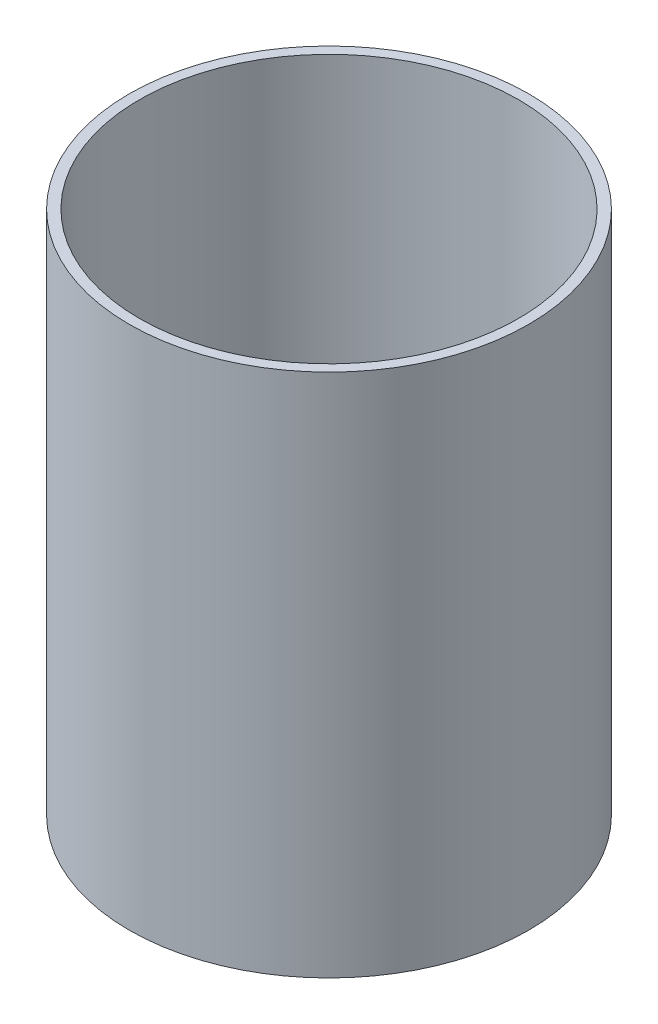
from build123d import *

# Parameters (mm, degrees)
SKETCH2_R           = 59
SKETCH2_R_2         = 56
BOSS_EXTRUDE2_DEPTH = 155


with BuildPart() as part:
    # Sketch2 → Boss-Extrude2 (new body)
    with BuildSketch(Plane(origin=(0, 0, 0), x_dir=(1, 0, 0), z_dir=(0, 1, 0))):
        with Locations(Location((0, 0, 0), (0, 0, 270))):
            Circle(SKETCH2_R)
        with Locations(Location((0, 0, 0), (0, 0, 270))):
            Circle(SKETCH2_R_2, mode=Mode.SUBTRACT)
    extrude(amount=BOSS_EXTRUDE2_DEPTH)


solid = part.part
